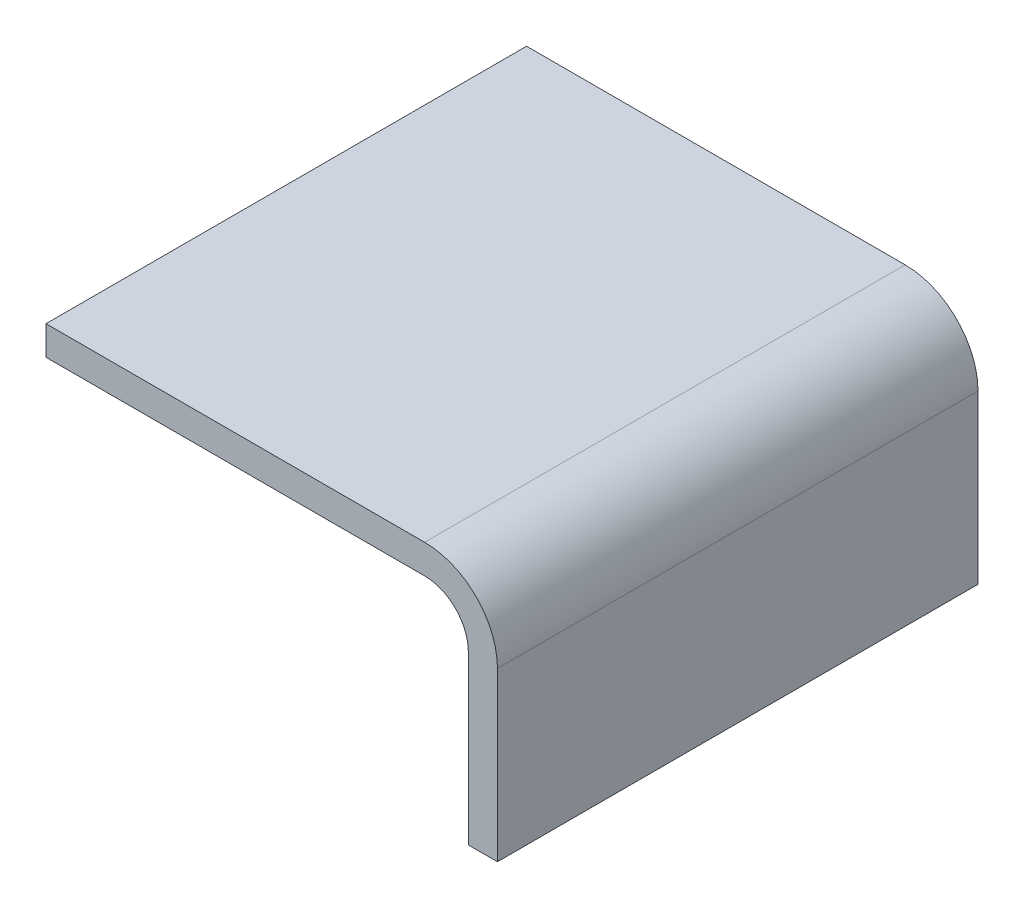
from build123d import *

# Parameters (mm, degrees)
BOSS_EXTRUDE1_DEPTH = 66


with BuildPart() as part:
    # Sketch1 → Boss-Extrude1 (new body)
    with BuildSketch(Plane.XY):
        with BuildLine():
            Line((0, 29), (52, 29))
            ThreePointArc((52, 29), (56.242640687, 27.242640687), (58, 23))
            Line((58, 23), (58, 0))
            Line((58, 0), (62, 0))
            Line((62, 0), (62, 23))
            ThreePointArc((62, 23), (59.071067812, 30.071067812), (52, 33))
            Line((52, 33), (0, 33))
            Line((0, 33), (0, 29))
        make_face()
    extrude(amount=BOSS_EXTRUDE1_DEPTH)


solid = part.part
